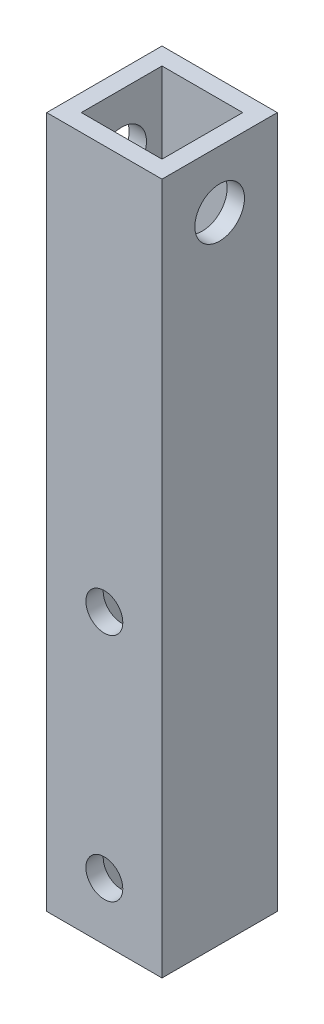
from build123d import *

# Parameters (mm, degrees)
SKETCH_1_W          = 10
SKETCH_1_H          = 10
SKETCH_1_W_2        = 7
SKETCH_1_H_2        = 7
EXTRUDE_1_DEPTH     = 60
SKETCH_2_R          = 1.6
CUT_EXTRUDE_1_DEPTH = 62.032778079
SKETCH_3_R          = 2.15
CUT_EXTRUDE_2_DEPTH = 62.032778079


with BuildPart() as part:
    # ｽｹｯﾁ1 → 押し出し-薄板1 (new body)
    with BuildSketch(Plane(origin=(0, 0, 0), x_dir=(1, 0, 0), z_dir=(0, 1, 0))):
        Rectangle(SKETCH_1_W, SKETCH_1_H)
        Rectangle(SKETCH_1_W_2, SKETCH_1_H_2, mode=Mode.SUBTRACT)
    extrude(amount=EXTRUDE_1_DEPTH)

    # ｽｹｯﾁ2 → ｶｯﾄ - 押し出し1 (cut, through all)
    with BuildSketch(Plane.XY.offset(5)):
        with Locations((0, 25)):
            Circle(SKETCH_2_R)
        with Locations((0, 5)):
            Circle(SKETCH_2_R)
    extrude(amount=-CUT_EXTRUDE_1_DEPTH, mode=Mode.SUBTRACT)

    # ｽｹｯﾁ3 → ｶｯﾄ - 押し出し2 (cut, through all)
    with BuildSketch(Plane(origin=(5, 0, 0), x_dir=(0, 0, -1), z_dir=(1, 0, 0))):
        with Locations((0, 55)):
            Circle(SKETCH_3_R)
    extrude(amount=-CUT_EXTRUDE_2_DEPTH, mode=Mode.SUBTRACT)


solid = part.part
